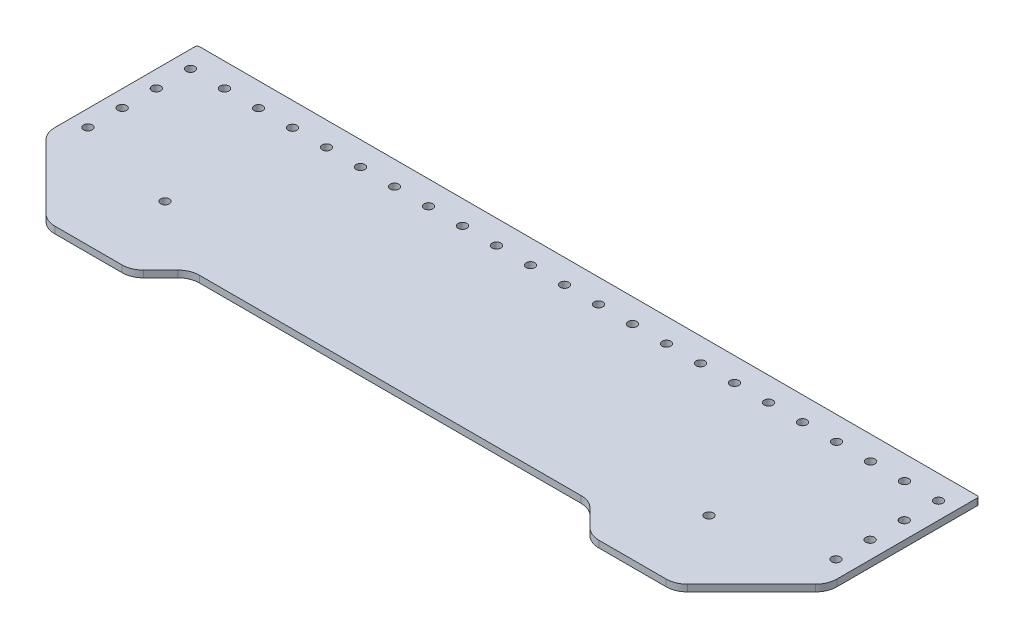
from build123d import *

# Parameters (mm, degrees)
SKETCH3_R           = 2.05
BOSS_EXTRUDE2_DEPTH = 3.175
FILLET1_R           = 10
FILLET2_R           = 1
SKETCH6_R           = 2.05
CUT_EXTRUDE3_DEPTH  = 3.18


with BuildPart() as part:
    # Sketch3 → Boss-Extrude2 (new body)
    with BuildSketch(Plane(origin=(0, 0, 0), x_dir=(1, 0, 0), z_dir=(0, 1, 0))):
        Polygon((-184, -11.5875), (-148, -47.5875), (-108, -47.5875), (-94, -33.5875), (94, -33.5875), (108, -47.5875), (148, -47.5875), (184, -11.5875), (184, 59.5875), (-184, 59.5875), align=None)
        with Locations(Location((-128, -11.5875, 0), (0, 0, 270))):
            Circle(SKETCH3_R, mode=Mode.SUBTRACT)
        with Locations(Location((128, -11.5875, 0), (0, 0, 90))):
            Circle(SKETCH3_R, mode=Mode.SUBTRACT)
    extrude(amount=BOSS_EXTRUDE2_DEPTH)

    # Fillet1
    fillet1_edges = [part.edges().sort_by_distance(p)[0] for p in [
        (184, 1.5875, 11.5875),
        (148, 1.5875, 47.5875),
        (108, 1.5875, 47.5875),
        (94, 1.5875, 33.5875),
        (-94, 1.5875, 33.5875),
        (-108, 1.5875, 47.5875),
        (-148, 1.5875, 47.5875),
        (-184, 1.5875, 11.5875),
    ]]
    fillet(fillet1_edges, radius=FILLET1_R)

    # Fillet2
    fillet2_edges = [part.edges().sort_by_distance(p)[0] for p in [
        (184, 1.5875, -59.5875),
        (-184, 1.5875, -59.5875),
    ]]
    fillet(fillet2_edges, radius=FILLET2_R)

    # Sketch6 → Cut-Extrude3 (cut)
    with BuildSketch(Plane(origin=(0, 3.175, 0), x_dir=(1, 0, 0), z_dir=(0, 1, 0))):
        with Locations(Location((-176, 48.4125, 0), (0, 0, 270))):
            Circle(SKETCH6_R)
        with Locations(Location((-160, 48.4125, 0), (0, 0, 270))):
            Circle(SKETCH6_R)
        with Locations(Location((-144, 48.4125, 0), (0, 0, 270))):
            Circle(SKETCH6_R)
        with Locations(Location((-128, 48.4125, 0), (0, 0, 270))):
            Circle(SKETCH6_R)
        with Locations(Location((-112, 48.4125, 0), (0, 0, 270))):
            Circle(SKETCH6_R)
        with Locations(Location((-96, 48.4125, 0), (0, 0, 270))):
            Circle(SKETCH6_R)
        with Locations(Location((-80, 48.4125, 0), (0, 0, 270))):
            Circle(SKETCH6_R)
        with Locations(Location((-64, 48.4125, 0), (0, 0, 270))):
            Circle(SKETCH6_R)
        with Locations(Location((-48, 48.4125, 0), (0, 0, 270))):
            Circle(SKETCH6_R)
        with Locations(Location((-32, 48.4125, 0), (0, 0, 270))):
            Circle(SKETCH6_R)
        with Locations(Location((-16, 48.4125, 0), (0, 0, 270))):
            Circle(SKETCH6_R)
        with Locations(Location((0, 48.4125, 0), (0, 0, 270))):
            Circle(SKETCH6_R)
        with Locations(Location((16, 48.4125, 0), (0, 0, 270))):
            Circle(SKETCH6_R)
        with Locations(Location((32, 48.4125, 0), (0, 0, 270))):
            Circle(SKETCH6_R)
        with Locations(Location((48, 48.4125, 0), (0, 0, 270))):
            Circle(SKETCH6_R)
        with Locations(Location((64, 48.4125, 0), (0, 0, 270))):
            Circle(SKETCH6_R)
        with Locations(Location((80, 48.4125, 0), (0, 0, 270))):
            Circle(SKETCH6_R)
        with Locations(Location((96, 48.4125, 0), (0, 0, 270))):
            Circle(SKETCH6_R)
        with Locations(Location((112, 48.4125, 0), (0, 0, 270))):
            Circle(SKETCH6_R)
        with Locations(Location((128, 48.4125, 0), (0, 0, 270))):
            Circle(SKETCH6_R)
        with Locations(Location((144, 48.4125, 0), (0, 0, 270))):
            Circle(SKETCH6_R)
        with Locations(Location((160, 48.4125, 0), (0, 0, 270))):
            Circle(SKETCH6_R)
        with Locations(Location((176, 48.4125, 0), (0, 0, 270))):
            Circle(SKETCH6_R)
        with Locations(Location((175.913104262, 32.412735966, 0), (0, 0, 270))):
            Circle(SKETCH6_R)
        with Locations(Location((175.826208525, 16.412971933, 0), (0, 0, 270))):
            Circle(SKETCH6_R)
        with Locations(Location((175.739312787, 0.413207899, 0), (0, 0, 270))):
            Circle(SKETCH6_R)
        with Locations(Location((-176.086895738, 32.412735966, 0), (0, 0, 270))):
            Circle(SKETCH6_R)
        with Locations(Location((-176.173791475, 16.412971933, 0), (0, 0, 270))):
            Circle(SKETCH6_R)
        with Locations(Location((-176.260687213, 0.413207899, 0), (0, 0, 270))):
            Circle(SKETCH6_R)
    extrude(amount=-CUT_EXTRUDE3_DEPTH, mode=Mode.SUBTRACT)


solid = part.part
